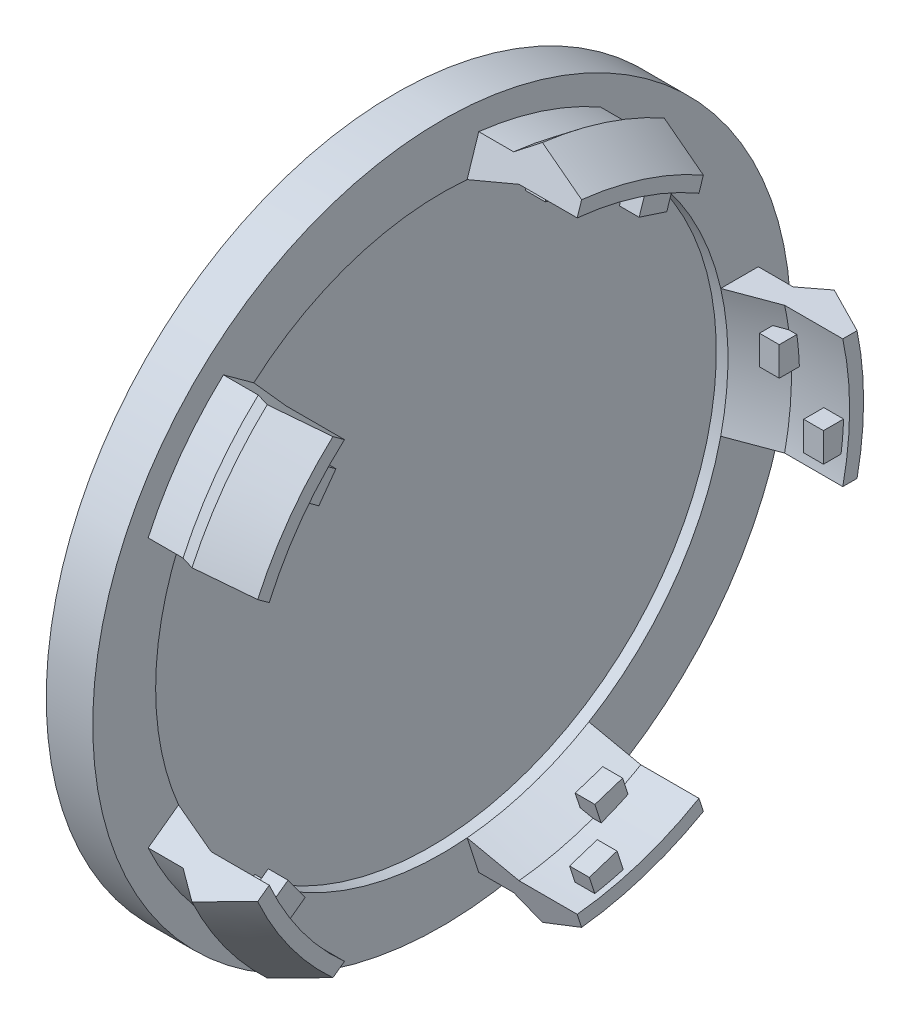
from build123d import *

# Parameters (mm, degrees)
CUT_EXTRUDE_1_DEPTH      = 9
SKETCH_4_W               = 1.7
SKETCH_4_H               = 2.5
EXTRUDE_1_DEPTH          = 2
PATTERN_CIRCULAR_1_COUNT = 5
SKETCH_5_R               = 24.3
CUT_EXTRUDE_2_DEPTH      = 1.5


with BuildPart() as part:
    # Эскиз1 → Повернуть1 (revolve)
    with BuildSketch(Plane.XY, mode=Mode.PRIVATE) as revolve_1_sk:
        Polygon((0, 30), (4, 30), (4, 26), (3, 26), (3, 0), (0, 0), align=None)
    revolve(revolve_1_sk.sketch.rotate(Axis((0, 0, 0), (-1, 0, 0)), 90), axis=Axis((0, 0, 0), (-1, 0, 0)))

    # Эскиз2 → Повернуть2 (revolve)
    with BuildSketch(Plane.XY, mode=Mode.PRIVATE) as revolve_2_sk:
        Polygon((4, 24.594119063), (8, 26.05), (13, 26.05), (13, 27.25), (9, 29.25), (7, 27.75), (3, 27.75), (3, 24.594119063), align=None)
    revolve(revolve_2_sk.sketch.rotate(Axis((0, 0, 0), (1, 0, 0)), 90), axis=Axis((0, 0, 0), (1, 0, 0)))

    # Эскиз3 → Вырез-Вытянуть1 (cut)
    with BuildSketch(Plane(origin=(13, 0, 0), x_dir=(0, 0, -1), z_dir=(1, 0, 0))):
        with BuildLine():
            ThreePointArc((13.478222015, -23.68332813), (22.045713097, -16.017148125), (26.689183202, -5.5))
            Line((26.689183202, -5.5), (25.462766935, -5.5))
            ThreePointArc((25.462766935, -5.5), (21.074892703, -15.311805822), (13.099238546, -22.516936948))
            Line((13.099238546, -22.516936948), (13.478222015, -23.68332813))
        make_face()
        with BuildLine():
            ThreePointArc((13.099238546, -22.516936948), (21.074892703, -15.311805822), (25.462766935, -5.5))
            Line((25.462766935, -5.5), (23.971247203, -5.5))
            ThreePointArc((23.971247203, -5.5), (19.897060284, -14.456060478), (12.638333602, -21.098417387))
            Line((12.638333602, -21.098417387), (13.099238546, -22.516936948))
        make_face()
        with BuildLine():
            ThreePointArc((-18.359183889, -20.137101751), (-8.420713097, -25.916290069), (3.016600336, -27.082515068))
            Line((3.016600336, -27.082515068), (2.637616867, -25.916123886))
            ThreePointArc((2.637616867, -25.916123886), (-8.049892703, -24.775022249), (-17.366992287, -19.416232356))
            Line((-17.366992287, -19.416232356), (-18.359183889, -20.137101751))
        make_face()
        with BuildLine():
            ThreePointArc((-17.366992287, -19.416232356), (-8.049892703, -24.775022249), (2.637616867, -25.916123886))
            Line((2.637616867, -25.916123886), (2.176711923, -24.497604325))
            ThreePointArc((2.176711923, -24.497604325), (-7.600000752, -23.390397197), (-16.160327476, -18.539539054))
            Line((-16.160327476, -18.539539054), (-17.366992287, -19.416232356))
        make_face()
        with BuildLine():
            Line((-23.832630062, 10.517045418), (-24.824821664, 11.237914813))
            ThreePointArc((-24.824821664, 11.237914813), (-27.25, 0), (-24.824821664, -11.237914813))
            Line((-24.824821664, -11.237914813), (-23.832630062, -10.517045418))
            ThreePointArc((-23.832630062, -10.517045418), (-26.05, 0), (-23.832630062, 10.517045418))
        make_face()
        with BuildLine():
            Line((-22.625965251, 9.640352116), (-23.832630062, 10.517045418))
            ThreePointArc((-23.832630062, 10.517045418), (-26.05, 0), (-23.832630062, -10.517045418))
            Line((-23.832630062, -10.517045418), (-22.625965251, -9.640352116))
            ThreePointArc((-22.625965251, -9.640352116), (-24.594119063, 0), (-22.625965251, 9.640352116))
        make_face()
        with BuildLine():
            Line((2.637616867, 25.916123886), (3.016600336, 27.082515068))
            ThreePointArc((3.016600336, 27.082515068), (-8.420713097, 25.916290069), (-18.359183889, 20.137101751))
            Line((-18.359183889, 20.137101751), (-17.366992287, 19.416232356))
            ThreePointArc((-17.366992287, 19.416232356), (-8.049892703, 24.775022249), (2.637616867, 25.916123886))
        make_face()
        with BuildLine():
            Line((2.176711923, 24.497604325), (2.637616867, 25.916123886))
            ThreePointArc((2.637616867, 25.916123886), (-8.049892703, 24.775022249), (-17.366992287, 19.416232356))
            Line((-17.366992287, 19.416232356), (-16.160327476, 18.539539054))
            ThreePointArc((-16.160327476, 18.539539054), (-7.600000752, 23.390397197), (2.176711923, 24.497604325))
        make_face()
        with BuildLine():
            Line((25.462766935, 5.5), (26.689183202, 5.5))
            ThreePointArc((26.689183202, 5.5), (22.045713097, 16.017148125), (13.478222015, 23.68332813))
            Line((13.478222015, 23.68332813), (13.099238546, 22.516936948))
            ThreePointArc((13.099238546, 22.516936948), (21.074892703, 15.311805822), (25.462766935, 5.5))
        make_face()
        with BuildLine():
            Line((23.971247203, 5.5), (25.462766935, 5.5))
            ThreePointArc((25.462766935, 5.5), (21.074892703, 15.311805822), (13.099238546, 22.516936948))
            Line((13.099238546, 22.516936948), (12.638333602, 21.098417387))
            ThreePointArc((12.638333602, 21.098417387), (19.897060284, 14.456060478), (23.971247203, 5.5))
        make_face()
        with BuildLine():
            Line((3.016600336, 27.082515068), (4.573471173, 31.874070813))
            ThreePointArc((4.573471173, 31.874070813), (-9.950505703, 30.624507588), (-22.435124657, 23.09844606))
            Line((-22.435124657, 23.09844606), (-18.359183889, 20.137101751))
            ThreePointArc((-18.359183889, 20.137101751), (-8.420713097, 25.916290069), (3.016600336, 27.082515068))
        make_face()
        with BuildLine():
            Line((-24.824821664, 11.237914813), (-28.900762432, 14.199259122))
            ThreePointArc((-28.900762432, 14.199259122), (-32.200512865, 0), (-28.900762432, -14.199259122))
            Line((-28.900762432, -14.199259122), (-24.824821664, -11.237914813))
            ThreePointArc((-24.824821664, -11.237914813), (-27.25, 0), (-24.824821664, 11.237914813))
        make_face()
        with BuildLine():
            ThreePointArc((-22.435124657, -23.09844606), (-9.950505703, -30.624507588), (4.573471173, -31.874070813))
            Line((4.573471173, -31.874070813), (3.016600336, -27.082515068))
            ThreePointArc((3.016600336, -27.082515068), (-8.420713097, -25.916290069), (-18.359183889, -20.137101751))
            Line((-18.359183889, -20.137101751), (-22.435124657, -23.09844606))
        make_face()
        with BuildLine():
            ThreePointArc((15.035092852, -28.474883875), (26.050762135, -18.926986578), (31.727323063, -5.5))
            Line((31.727323063, -5.5), (26.689183202, -5.5))
            ThreePointArc((26.689183202, -5.5), (22.045713097, -16.017148125), (13.478222015, -23.68332813))
            Line((13.478222015, -23.68332813), (15.035092852, -28.474883875))
        make_face()
        with BuildLine():
            Line((26.689183202, 5.5), (31.727323063, 5.5))
            ThreePointArc((31.727323063, 5.5), (26.050762135, 18.926986578), (15.035092852, 28.474883875))
            Line((15.035092852, 28.474883875), (13.478222015, 23.68332813))
            ThreePointArc((13.478222015, 23.68332813), (22.045713097, 16.017148125), (26.689183202, 5.5))
        make_face()
    extrude(amount=-CUT_EXTRUDE_1_DEPTH, mode=Mode.SUBTRACT)

    # Эскиз4 → Бобышка-Вытянуть1 (add)
    with BuildSketch(Plane.XY.offset(-24.3)):
        with Locations((11.65, -2.25)):
            Rectangle(SKETCH_4_W, SKETCH_4_H)
        with Locations((7.85, 2.25)):
            Rectangle(SKETCH_4_W, SKETCH_4_H)
    extrude_1 = extrude(amount=-EXTRUDE_1_DEPTH)

    # Круговой массив1: Бобышка-Вытянуть1 ×5 about axis
    pattern_circular_1_axis = Axis((0, 0, 0), (1, 0, 0))
    for i in range(1, PATTERN_CIRCULAR_1_COUNT):
        add(extrude_1.rotate(pattern_circular_1_axis, i * 360 / PATTERN_CIRCULAR_1_COUNT))

    # Эскиз5 → Вырез-Вытянуть2 (cut)
    with BuildSketch(Plane(origin=(0, 0, 0), x_dir=(0, 0, -1), z_dir=(1, 0, 0))):
        with Locations(Location((0, 0, 0), (0, 0, 180))):
            Circle(SKETCH_5_R)
        with BuildLine():
            Line((-5.087573742, 18.513686651), (0, 6.870909772))
            Line((0, 6.870909772), (5.087573742, 18.513686651))
            ThreePointArc((5.087573742, 18.513686651), (0, 19.2), (-5.087573742, 18.513686651))
        make_face(mode=Mode.SUBTRACT)
        with BuildLine():
            Line((-10.213287696, 16.25819038), (-3.196299518, 0.2))
            Line((-3.196299518, 0.2), (3.196299518, 0.2))
            Line((3.196299518, 0.2), (10.213287696, 16.25819038))
            ThreePointArc((10.213287696, 16.25819038), (12.879492014, 14.239335851), (15.154936685, 11.788464449))
            Line((15.154936685, 11.788464449), (6.970698587, -7.322816425))
            Line((6.970698587, -7.322816425), (3.180185716, -0.2))
            Line((3.180185716, -0.2), (-3.180185716, -0.2))
            Line((-3.180185716, -0.2), (-6.970698587, -7.322816425))
            Line((-6.970698587, -7.322816425), (-15.154936685, 11.788464449))
            ThreePointArc((-15.154936685, 11.788464449), (-12.879492014, 14.239335851), (-10.213287696, 16.25819038))
        make_face(mode=Mode.SUBTRACT)
        with BuildLine():
            Line((-8.901263668, -17.011981223), (-18.454870493, 5.296957155))
            ThreePointArc((-18.454870493, 5.296957155), (-17.649694103, -7.558326406), (-8.901263668, -17.011981223))
        make_face(mode=Mode.SUBTRACT)
        with BuildLine():
            Line((0, -7.230363982), (-5.083762601, -18.514733534))
            ThreePointArc((-5.083762601, -18.514733534), (0, -19.2), (5.083762601, -18.514733534))
            Line((5.083762601, -18.514733534), (0, -7.230363982))
        make_face(mode=Mode.SUBTRACT)
        with BuildLine():
            Line((8.901263668, -17.011981223), (18.454870493, 5.296957155))
            ThreePointArc((18.454870493, 5.296957155), (17.649694103, -7.558326406), (8.901263668, -17.011981223))
        make_face(mode=Mode.SUBTRACT)
    extrude(amount=CUT_EXTRUDE_2_DEPTH, mode=Mode.SUBTRACT)


solid = part.part
